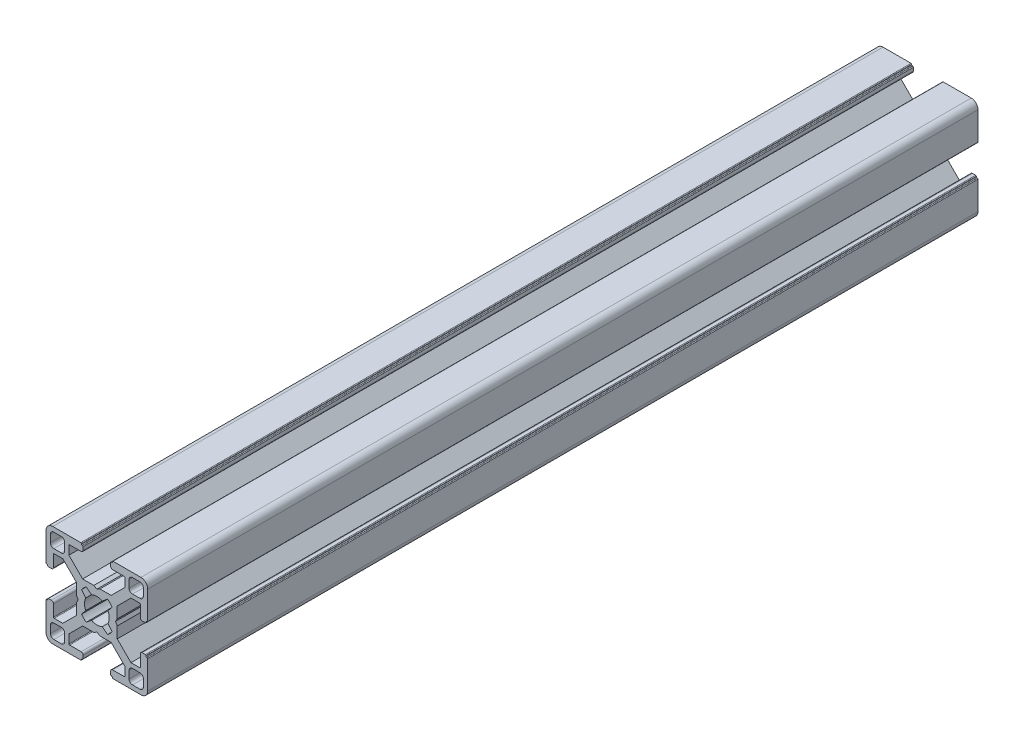
from build123d import *

# Parameters (mm, degrees)
BOSS_EXTRUDE1_DEPTH = 244.8


with BuildPart() as part:
    # Sketch1 → Boss-Extrude1 (new body)
    with BuildSketch(Plane.XY):
        with BuildLine():
            Line((6.00446543, 0.899999619), (5.484852164, 0))
            Line((5.484852164, 0), (6.00446543, -0.899999619))
            Line((6.00446543, -0.899999619), (6.00446543, -4.204465866))
            Line((6.00446543, -4.204465866), (10.049999564, -8.25))
            Line((10.049999564, -8.25), (12.59999928, -8.25))
            ThreePointArc((12.59999928, -8.25), (12.741420837, -8.191421273), (12.799999564, -8.049999716))
            Line((12.799999564, -8.049999716), (12.799999564, -4.649999613))
            ThreePointArc((12.799999564, -4.649999613), (12.975735606, -4.225735278), (13.39999994, -4.049999237))
            Line((13.39999994, -4.049999237), (14.300000043, -4.049999237))
            ThreePointArc((14.300000043, -4.049999237), (14.4414216, -4.108577964), (14.500000327, -4.249999521))
            Line((14.500000327, -4.249999521), (14.500000327, -4.349998953))
            ThreePointArc((14.500000327, -4.349998953), (14.558579054, -4.49142051), (14.700000611, -4.549999237))
            Line((14.700000611, -4.549999237), (14.799999716, -4.549999237))
            ThreePointArc((14.799999716, -4.549999237), (14.941421273, -4.608577964), (15, -4.749999521))
            Line((15, -4.749999521), (15, -13.000000346))
            ThreePointArc((15, -13.000000346), (14.414213664, -14.414213664), (13.000000346, -15))
            Line((13.000000346, -15), (4.749999945, -15))
            ThreePointArc((4.749999945, -15), (4.60857832, -14.941421245), (4.549999564, -14.799999619))
            Line((4.549999564, -14.799999619), (4.549999564, -14.69999942))
            ThreePointArc((4.549999564, -14.69999942), (4.49142109, -14.558578474), (4.350000144, -14.5))
            Line((4.350000144, -14.5), (4.250000374, -14.5))
            ThreePointArc((4.250000374, -14.5), (4.108578753, -14.441421247), (4.05, -14.299999626))
            Line((4.05, -14.299999626), (4.05, -13.399999434))
            ThreePointArc((4.05, -13.399999434), (4.225735989, -12.975735226), (4.650000197, -12.799999237))
            Line((4.650000197, -12.799999237), (8.049999924, -12.799999237))
            ThreePointArc((8.049999924, -12.799999237), (8.191421565, -12.741420475), (8.250000327, -12.599998834))
            Line((8.250000327, -12.599998834), (8.250000327, -10.049999237))
            Line((8.250000327, -10.049999237), (4.204466193, -6))
            Line((4.204466193, -6), (0.899999946, -6))
            Line((0.899999946, -6), (0, -5.484851837))
            Line((0, -5.484851837), (-0.899999946, -6))
            Line((-0.899999946, -6), (-4.204466193, -6))
            Line((-4.204466193, -6), (-8.250000327, -10.049999237))
            Line((-8.250000327, -10.049999237), (-8.250000327, -12.599998834))
            ThreePointArc((-8.250000327, -12.599998834), (-8.191421565, -12.741420475), (-8.049999924, -12.799999237))
            Line((-8.049999924, -12.799999237), (-4.650000197, -12.799999237))
            ThreePointArc((-4.650000197, -12.799999237), (-4.225735989, -12.975735226), (-4.05, -13.399999434))
            Line((-4.05, -13.399999434), (-4.05, -14.299999626))
            ThreePointArc((-4.05, -14.299999626), (-4.108578753, -14.441421247), (-4.250000374, -14.5))
            Line((-4.250000374, -14.5), (-4.350000144, -14.5))
            ThreePointArc((-4.350000144, -14.5), (-4.49142109, -14.558578474), (-4.549999564, -14.69999942))
            Line((-4.549999564, -14.69999942), (-4.549999564, -14.799999619))
            ThreePointArc((-4.549999564, -14.799999619), (-4.60857832, -14.941421245), (-4.749999945, -15))
            Line((-4.749999945, -15), (-13.000000346, -15))
            ThreePointArc((-13.000000346, -15), (-14.414213664, -14.414213664), (-15, -13.000000346))
            Line((-15, -13.000000346), (-15, -4.749999521))
            ThreePointArc((-15, -4.749999521), (-14.941421273, -4.608577964), (-14.799999716, -4.549999237))
            Line((-14.799999716, -4.549999237), (-14.700000611, -4.549999237))
            ThreePointArc((-14.700000611, -4.549999237), (-14.558579054, -4.49142051), (-14.500000327, -4.349998953))
            Line((-14.500000327, -4.349998953), (-14.500000327, -4.249999521))
            ThreePointArc((-14.500000327, -4.249999521), (-14.4414216, -4.108577964), (-14.300000043, -4.049999237))
            Line((-14.300000043, -4.049999237), (-13.39999994, -4.049999237))
            ThreePointArc((-13.39999994, -4.049999237), (-12.975735606, -4.225735278), (-12.799999564, -4.649999613))
            Line((-12.799999564, -4.649999613), (-12.799999564, -8.049999716))
            ThreePointArc((-12.799999564, -8.049999716), (-12.741420837, -8.191421273), (-12.59999928, -8.25))
            Line((-12.59999928, -8.25), (-10.049999564, -8.25))
            Line((-10.049999564, -8.25), (-6.00446543, -4.204465866))
            Line((-6.00446543, -4.204465866), (-6.00446543, -0.899999619))
            Line((-6.00446543, -0.899999619), (-5.484852164, 0))
            Line((-5.484852164, 0), (-6.00446543, 0.899999619))
            Line((-6.00446543, 0.899999619), (-6.00446543, 4.204465866))
            Line((-6.00446543, 4.204465866), (-10.049999564, 8.25))
            Line((-10.049999564, 8.25), (-12.59999928, 8.25))
            ThreePointArc((-12.59999928, 8.25), (-12.741420837, 8.191421273), (-12.799999564, 8.049999716))
            Line((-12.799999564, 8.049999716), (-12.799999564, 4.649999613))
            ThreePointArc((-12.799999564, 4.649999613), (-12.975735606, 4.225735278), (-13.39999994, 4.049999237))
            Line((-13.39999994, 4.049999237), (-14.300000043, 4.049999237))
            ThreePointArc((-14.300000043, 4.049999237), (-14.4414216, 4.108577964), (-14.500000327, 4.249999521))
            Line((-14.500000327, 4.249999521), (-14.500000327, 4.349998953))
            ThreePointArc((-14.500000327, 4.349998953), (-14.558579054, 4.49142051), (-14.700000611, 4.549999237))
            Line((-14.700000611, 4.549999237), (-14.799999716, 4.549999237))
            ThreePointArc((-14.799999716, 4.549999237), (-14.941421273, 4.608577964), (-15, 4.749999521))
            Line((-15, 4.749999521), (-15, 13.000000346))
            ThreePointArc((-15, 13.000000346), (-14.414213664, 14.414213664), (-13.000000346, 15))
            Line((-13.000000346, 15), (-4.749999945, 15))
            ThreePointArc((-4.749999945, 15), (-4.60857832, 14.941421245), (-4.549999564, 14.799999619))
            Line((-4.549999564, 14.799999619), (-4.549999564, 14.69999942))
            ThreePointArc((-4.549999564, 14.69999942), (-4.49142109, 14.558578474), (-4.350000144, 14.5))
            Line((-4.350000144, 14.5), (-4.250000374, 14.5))
            ThreePointArc((-4.250000374, 14.5), (-4.108578753, 14.441421247), (-4.05, 14.299999626))
            Line((-4.05, 14.299999626), (-4.05, 13.399999434))
            ThreePointArc((-4.05, 13.399999434), (-4.225735989, 12.975735226), (-4.650000197, 12.799999237))
            Line((-4.650000197, 12.799999237), (-8.049999924, 12.799999237))
            ThreePointArc((-8.049999924, 12.799999237), (-8.191421565, 12.741420475), (-8.250000327, 12.599998834))
            Line((-8.250000327, 12.599998834), (-8.250000327, 10.049999237))
            Line((-8.250000327, 10.049999237), (-4.204466193, 6))
            Line((-4.204466193, 6), (-0.899999946, 6))
            Line((-0.899999946, 6), (0, 5.484851837))
            Line((0, 5.484851837), (0.899999946, 6))
            Line((0.899999946, 6), (4.204466193, 6))
            Line((4.204466193, 6), (8.250000327, 10.049999237))
            Line((8.250000327, 10.049999237), (8.250000327, 12.599998834))
            ThreePointArc((8.250000327, 12.599998834), (8.191421565, 12.741420475), (8.049999924, 12.799999237))
            Line((8.049999924, 12.799999237), (4.650000197, 12.799999237))
            ThreePointArc((4.650000197, 12.799999237), (4.225735989, 12.975735226), (4.05, 13.399999434))
            Line((4.05, 13.399999434), (4.05, 14.299999626))
            ThreePointArc((4.05, 14.299999626), (4.108578753, 14.441421247), (4.250000374, 14.5))
            Line((4.250000374, 14.5), (4.350000144, 14.5))
            ThreePointArc((4.350000144, 14.5), (4.49142109, 14.558578474), (4.549999564, 14.69999942))
            Line((4.549999564, 14.69999942), (4.549999564, 14.799999619))
            ThreePointArc((4.549999564, 14.799999619), (4.60857832, 14.941421245), (4.749999945, 15))
            Line((4.749999945, 15), (13.000000346, 15))
            ThreePointArc((13.000000346, 15), (14.414213664, 14.414213664), (15, 13.000000346))
            Line((15, 13.000000346), (15, 4.749999521))
            ThreePointArc((15, 4.749999521), (14.941421273, 4.608577964), (14.799999716, 4.549999237))
            Line((14.799999716, 4.549999237), (14.700000611, 4.549999237))
            ThreePointArc((14.700000611, 4.549999237), (14.558579054, 4.49142051), (14.500000327, 4.349998953))
            Line((14.500000327, 4.349998953), (14.500000327, 4.249999521))
            ThreePointArc((14.500000327, 4.249999521), (14.4414216, 4.108577964), (14.300000043, 4.049999237))
            Line((14.300000043, 4.049999237), (13.39999994, 4.049999237))
            ThreePointArc((13.39999994, 4.049999237), (12.975735606, 4.225735278), (12.799999564, 4.649999613))
            Line((12.799999564, 4.649999613), (12.799999564, 8.049999716))
            ThreePointArc((12.799999564, 8.049999716), (12.741420837, 8.191421273), (12.59999928, 8.25))
            Line((12.59999928, 8.25), (10.049999564, 8.25))
            Line((10.049999564, 8.25), (6.00446543, 4.204465866))
            Line((6.00446543, 4.204465866), (6.00446543, 0.899999619))
        make_face()
        with BuildLine():
            Line((13.70000109, 12.700000398), (13.70000109, 10.499999635))
            ThreePointArc((13.70000109, 10.499999635), (13.407107874, 9.792892851), (12.70000109, 9.499999635))
            Line((12.70000109, 9.499999635), (10.500000327, 9.499999635))
            ThreePointArc((10.500000327, 9.499999635), (9.792893543, 9.792892851), (9.500000327, 10.499999635))
            Line((9.500000327, 10.499999635), (9.500000327, 12.700000398))
            ThreePointArc((9.500000327, 12.700000398), (9.792893543, 13.407107182), (10.500000327, 13.700000398))
            Line((10.500000327, 13.700000398), (12.70000109, 13.700000398))
            ThreePointArc((12.70000109, 13.700000398), (13.407107874, 13.407107182), (13.70000109, 12.700000398))
        make_face(mode=Mode.SUBTRACT)
        with BuildLine():
            Line((3.135929412, 4.518400903), (1.600129524, 3.280561767))
            ThreePointArc((1.600129524, 3.280561767), (0, 3.65), (-1.600129524, 3.280561767))
            Line((-1.600129524, 3.280561767), (-3.135929412, 4.518400903))
            ThreePointArc((-3.135929412, 4.518400903), (-3.881002259, 3.897155561), (-4.505336892, 3.154669473))
            Line((-4.505336892, 3.154669473), (-3.280561732, 1.600129597))
            ThreePointArc((-3.280561732, 1.600129597), (-3.65, 0), (-3.280561732, -1.600129597))
            Line((-3.280561732, -1.600129597), (-4.505336892, -3.154669473))
            ThreePointArc((-4.505336892, -3.154669473), (-3.881002259, -3.897155561), (-3.135929412, -4.518400903))
            Line((-3.135929412, -4.518400903), (-1.600129524, -3.280561767))
            ThreePointArc((-1.600129524, -3.280561767), (0, -3.65), (1.600129524, -3.280561767))
            Line((1.600129524, -3.280561767), (3.135929412, -4.518400903))
            ThreePointArc((3.135929412, -4.518400903), (3.881002259, -3.897155561), (4.505336892, -3.154669473))
            Line((4.505336892, -3.154669473), (3.280561732, -1.600129597))
            ThreePointArc((3.280561732, -1.600129597), (3.65, 0), (3.280561732, 1.600129597))
            Line((3.280561732, 1.600129597), (4.505336892, 3.154669473))
            ThreePointArc((4.505336892, 3.154669473), (3.881002259, 3.897155561), (3.135929412, 4.518400903))
        make_face(mode=Mode.SUBTRACT)
        with BuildLine():
            Line((-13.70000109, -12.700000398), (-13.70000109, -10.499999635))
            ThreePointArc((-13.70000109, -10.499999635), (-13.407107874, -9.792892851), (-12.70000109, -9.499999635))
            Line((-12.70000109, -9.499999635), (-10.500000327, -9.499999635))
            ThreePointArc((-10.500000327, -9.499999635), (-9.792893543, -9.792892851), (-9.500000327, -10.499999635))
            Line((-9.500000327, -10.499999635), (-9.500000327, -12.700000398))
            ThreePointArc((-9.500000327, -12.700000398), (-9.792893543, -13.407107182), (-10.500000327, -13.700000398))
            Line((-10.500000327, -13.700000398), (-12.70000109, -13.700000398))
            ThreePointArc((-12.70000109, -13.700000398), (-13.407107874, -13.407107182), (-13.70000109, -12.700000398))
        make_face(mode=Mode.SUBTRACT)
        with BuildLine():
            Line((10.500000327, -13.700000398), (12.70000109, -13.700000398))
            ThreePointArc((12.70000109, -13.700000398), (13.407107874, -13.407107182), (13.70000109, -12.700000398))
            Line((13.70000109, -12.700000398), (13.70000109, -10.499999635))
            ThreePointArc((13.70000109, -10.499999635), (13.407107874, -9.792892851), (12.70000109, -9.499999635))
            Line((12.70000109, -9.499999635), (10.500000327, -9.499999635))
            ThreePointArc((10.500000327, -9.499999635), (9.792893543, -9.792892851), (9.500000327, -10.499999635))
            Line((9.500000327, -10.499999635), (9.500000327, -12.700000398))
            ThreePointArc((9.500000327, -12.700000398), (9.792893543, -13.407107182), (10.500000327, -13.700000398))
        make_face(mode=Mode.SUBTRACT)
        with BuildLine():
            Line((-10.500000327, 13.700000398), (-12.70000109, 13.700000398))
            ThreePointArc((-12.70000109, 13.700000398), (-13.407107874, 13.407107182), (-13.70000109, 12.700000398))
            Line((-13.70000109, 12.700000398), (-13.70000109, 10.499999635))
            ThreePointArc((-13.70000109, 10.499999635), (-13.407107874, 9.792892851), (-12.70000109, 9.499999635))
            Line((-12.70000109, 9.499999635), (-10.500000327, 9.499999635))
            ThreePointArc((-10.500000327, 9.499999635), (-9.792893543, 9.792892851), (-9.500000327, 10.499999635))
            Line((-9.500000327, 10.499999635), (-9.500000327, 12.700000398))
            ThreePointArc((-9.500000327, 12.700000398), (-9.792893543, 13.407107182), (-10.500000327, 13.700000398))
        make_face(mode=Mode.SUBTRACT)
    extrude(amount=BOSS_EXTRUDE1_DEPTH)


solid = part.part
